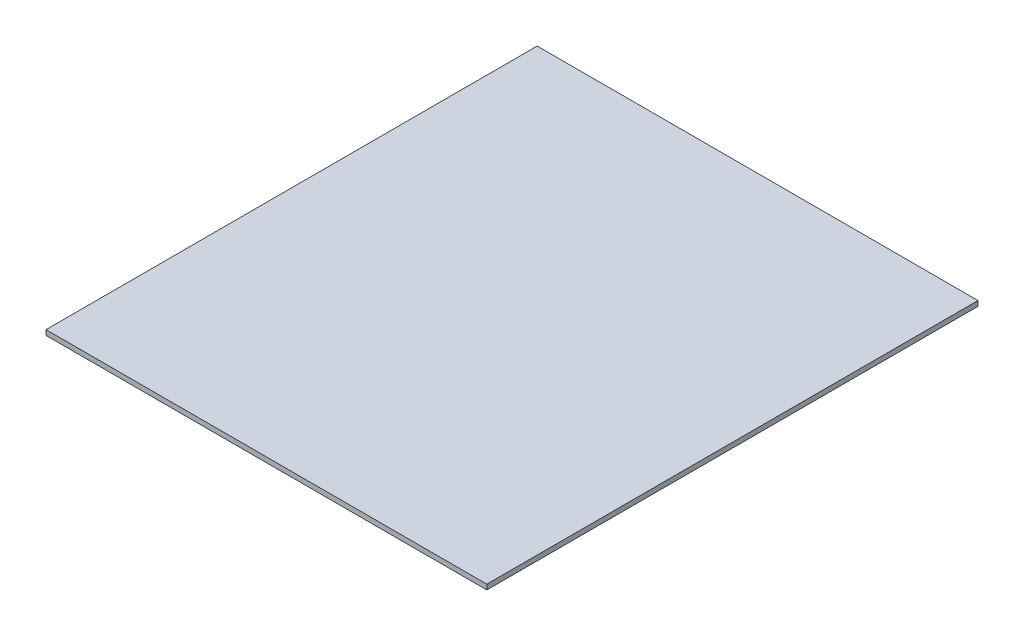
from build123d import *

# Parameters (mm, degrees)
SKETCH1_W           = 350
SKETCH1_H           = 390
BOSS_EXTRUDE1_DEPTH = 2


with BuildPart() as part:
    # Sketch1 → Boss-Extrude1 (new, symmetric)
    with BuildSketch(Plane(origin=(0, 0, 0), x_dir=(1, 0, 0), z_dir=(0, 1, 0))):
        Rectangle(SKETCH1_W, SKETCH1_H)
    extrude(amount=BOSS_EXTRUDE1_DEPTH, both=True)


solid = part.part
